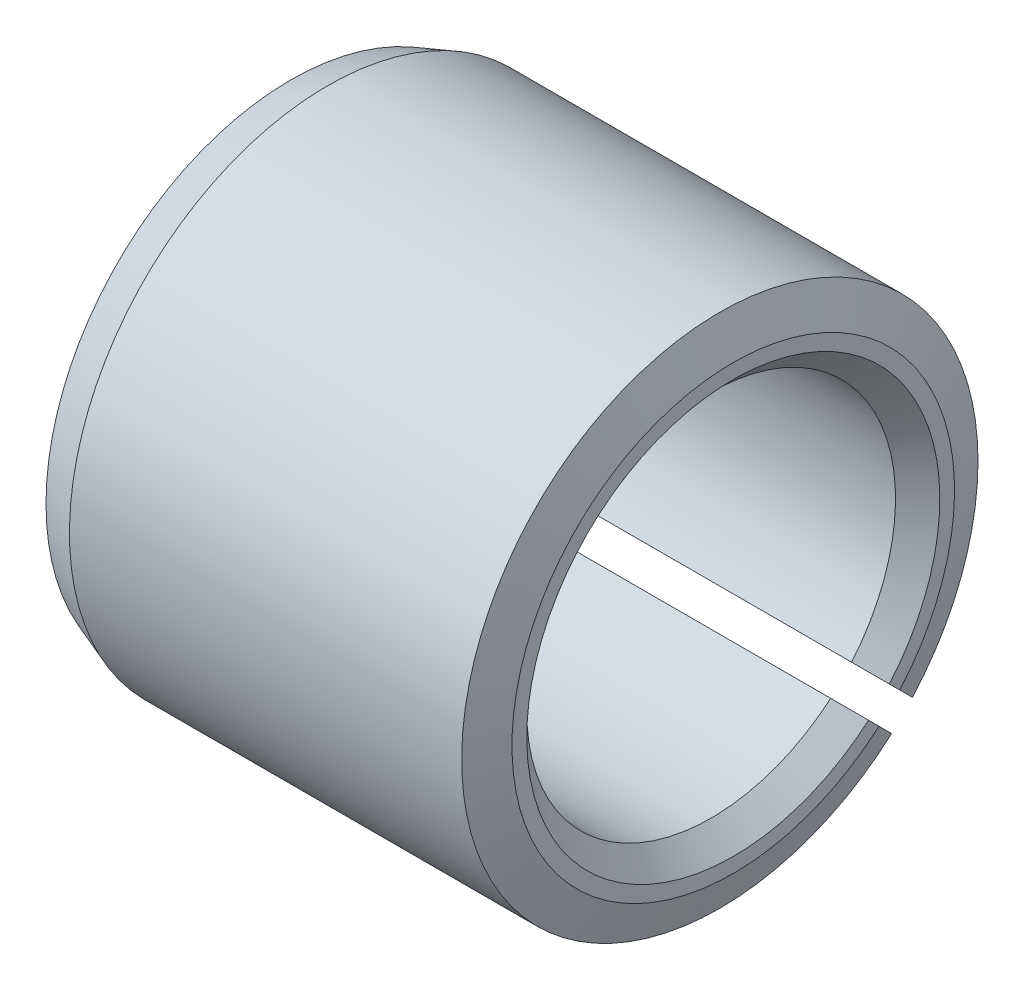
from build123d import *
from OCP.BRepFilletAPI import BRepFilletAPI_MakeChamfer

# Parameters (mm, degrees)
SKETCH1_W          = 6
SKETCH1_H          = 3.5
CUT_EXTRUDE1_DEPTH = 8.778174593
SKETCH3_W          = 6
SKETCH3_H          = 2.5
CHAMFER1_SIZE      = 0.3
CHAMFER2_SIZE      = 0.181985117
CHAMFER2_SIZE2     = 0.5


with BuildPart() as part:
    # Sketch1 → Revolve1 (revolve)
    with BuildSketch(Plane.XY, mode=Mode.PRIVATE) as revolve1_sk:
        with Locations((3, 1.75)):
            Rectangle(SKETCH1_W, SKETCH1_H)
    revolve(revolve1_sk.sketch.rotate(Axis((0, 0, 0), (1, 0, 0)), 270), axis=Axis((0, 0, 0), (1, 0, 0)))

    # Sketch2 → Cut-Extrude1 (cut, through all)
    with BuildSketch(Plane.ZY):
        with BuildLine():
            Line((-2.329408464, -2.612251176), (-1.620679662, -1.903522375))
            ThreePointArc((-1.620679662, -1.903522375), (-1.767766953, -1.767766953), (-1.903522375, -1.620679662))
            Line((-1.903522375, -1.620679662), (-2.612251176, -2.329408464))
            ThreePointArc((-2.612251176, -2.329408464), (-2.474873734, -2.474873734), (-2.329408464, -2.612251176))
        make_face()
    extrude(amount=-CUT_EXTRUDE1_DEPTH, mode=Mode.SUBTRACT)

    # Sketch3 → Cut-Revolve1 (revolve, cut)
    with BuildSketch(Plane.XY):
        with Locations((3, 1.25)):
            Rectangle(SKETCH3_W, SKETCH3_H)
    revolve(axis=Axis((0, 0, 0), (1, 0, 0)), mode=Mode.SUBTRACT)

    # Chamfer1
    chamfer1_edges = [part.edges().sort_by_distance(p)[0] for p in [
        (0, -0.863479607, 2.346146408),
        (6, -0.863479607, 2.346146408),
    ]]
    chamfer(chamfer1_edges, length=CHAMFER1_SIZE)

    # Chamfer2: one chamfer whose edges measure the first distance from different faces: ONE call of the kernel's chamfer builder (chamfer() names one face for all edges)
    chamfer2_edges_1 = [part.edges().sort_by_distance(p)[0] for p in [
        (0, 2.474873734, 2.474873734),
    ]]
    chamfer2_side_1 = [part.faces().sort_by_distance(p)[0] for p in [
        (0, -2.434257149, -2.011414437),
    ]]
    chamfer2_edges_2 = [part.edges().sort_by_distance(p)[0] for p in [
        (6, 2.474873734, 2.474873734),
    ]]
    chamfer2_side_2 = [part.faces().sort_by_distance(p)[0] for p in [
        (3, 2.474873734, 2.474873734),
    ]]
    chamfer2 = BRepFilletAPI_MakeChamfer(part.part.solid().wrapped)
    for e in chamfer2_edges_1:
        chamfer2.Add(CHAMFER2_SIZE, CHAMFER2_SIZE2, e.wrapped, chamfer2_side_1[0].wrapped)  # the first distance lies on this face
    for e in chamfer2_edges_2:
        chamfer2.Add(CHAMFER2_SIZE, CHAMFER2_SIZE2, e.wrapped, chamfer2_side_2[0].wrapped)  # the first distance lies on this face
    add(Compound.cast(chamfer2.Shape()), mode=Mode.REPLACE)


solid = part.part
